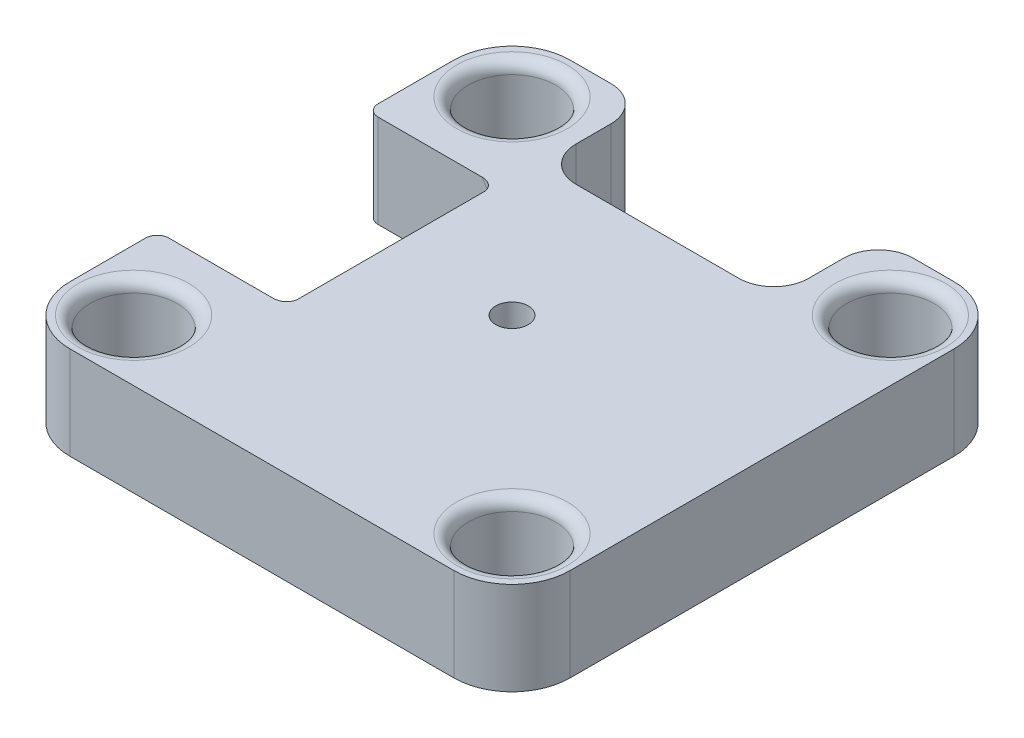
from build123d import *

# Parameters (mm, degrees)
SKETCH1_W           = 54.61
SKETCH1_H           = 54.61
SKETCH1_R           = 4.7625
BOSS_EXTRUDE1_DEPTH = 5.08
FILLET1_R           = 6.35
FILLET2_R           = 1.27
CUT_EXTRUDE1_DEPTH  = 11.43
SKETCH5_R           = 1.778
CUT_EXTRUDE2_DEPTH  = 40.569009919
FILLET3_R           = 1.27
SKETCH6_W           = 25.4
SKETCH6_H           = 22.86
CUT_EXTRUDE3_DEPTH  = 40.929333203
FILLET4_R           = 3.81


with BuildPart() as part:
    # Sketch1 → Boss-Extrude1 (new, symmetric)
    with BuildSketch(Plane(origin=(0, 0, 0), x_dir=(1, 0, 0), z_dir=(0, 1, 0))):
        Rectangle(SKETCH1_W, SKETCH1_H)
        with Locations(Location((-20.654589078, 20.654589078, 0), (0, 0, 270))):
            Circle(SKETCH1_R, mode=Mode.SUBTRACT)
        with Locations(Location((20.654589078, 20.654589078, 0), (0, 0, 270))):
            Circle(SKETCH1_R, mode=Mode.SUBTRACT)
        with Locations(Location((20.654589078, -20.654589078, 0), (0, 0, 270))):
            Circle(SKETCH1_R, mode=Mode.SUBTRACT)
        with Locations(Location((-20.654589078, -20.654589078, 0), (0, 0, 270))):
            Circle(SKETCH1_R, mode=Mode.SUBTRACT)
    extrude(amount=BOSS_EXTRUDE1_DEPTH, both=True)

    # Fillet1
    fillet1_edges = [part.edges().sort_by_distance(p)[0] for p in [
        (-27.305, 0, -27.305),
        (27.305, 0, -27.305),
        (27.305, 0, 27.305),
        (-27.305, 0, 27.305),
    ]]
    fillet(fillet1_edges, radius=FILLET1_R)

    # Fillet2
    fillet2_edges = [part.edges().sort_by_distance(p)[0] for p in [
        (-20.654589078, -5.08, -25.417089078),
        (-20.654589078, 5.08, -25.417089078),
        (20.654589078, -5.08, -25.417089078),
        (20.654589078, 5.08, -25.417089078),
        (20.654589078, -5.08, 15.892089078),
        (20.654589078, 5.08, 15.892089078),
        (-20.654589078, -5.08, 15.892089078),
        (-20.654589078, 5.08, 15.892089078),
    ]]
    fillet(fillet2_edges, radius=FILLET2_R)

    # Sketch4 → Cut-Extrude1 (cut, symmetric)
    with BuildSketch(Plane.XY):
        Polygon((-27.305, 5.08), (-13.208, 5.08), (-8.128, -3.556), (11.43, -3.556), (11.43, -5.08), (-27.305, -5.08), align=None)
    extrude(amount=CUT_EXTRUDE1_DEPTH, both=True, mode=Mode.SUBTRACT)

    # Sketch5 → Cut-Extrude2 (cut, through all)
    with BuildSketch(Plane.XZ.offset(3.556)):
        with Locations(Location((0, 0, 0), (0, 0, 270))):
            Circle(SKETCH5_R)
    extrude(amount=-CUT_EXTRUDE2_DEPTH, mode=Mode.SUBTRACT)

    # Fillet3
    fillet3_edges = [part.edges().sort_by_distance(p)[0] for p in [
        (-27.305, 0, -11.43),
        (-10.668, 0.762, -11.43),
        (1.651, -3.556, -11.43),
        (-8.128, -3.556, 0),
        (11.43, -3.556, 0),
        (-27.305, 0, 11.43),
        (1.651, -3.556, 11.43),
        (-10.668, 0.762, 11.43),
    ]]
    fillet(fillet3_edges, radius=FILLET3_R)

    # Sketch6 → Cut-Extrude3 (cut, through all)
    with BuildSketch(Plane(origin=(0, 5.08, 0), x_dir=(1, 0, 0), z_dir=(0, 1, 0))):
        with Locations((0, 27.305)):
            Rectangle(SKETCH6_W, SKETCH6_H)
    extrude(amount=-CUT_EXTRUDE3_DEPTH, mode=Mode.SUBTRACT)

    # Fillet4
    fillet4_edges = [part.edges().sort_by_distance(p)[0] for p in [
        (-12.7, 0, -27.305),
        (12.7, 0, -27.305),
        (-12.7, 0, -15.875),
        (12.7, 0, -15.875),
    ]]
    fillet(fillet4_edges, radius=FILLET4_R)


solid = part.part
